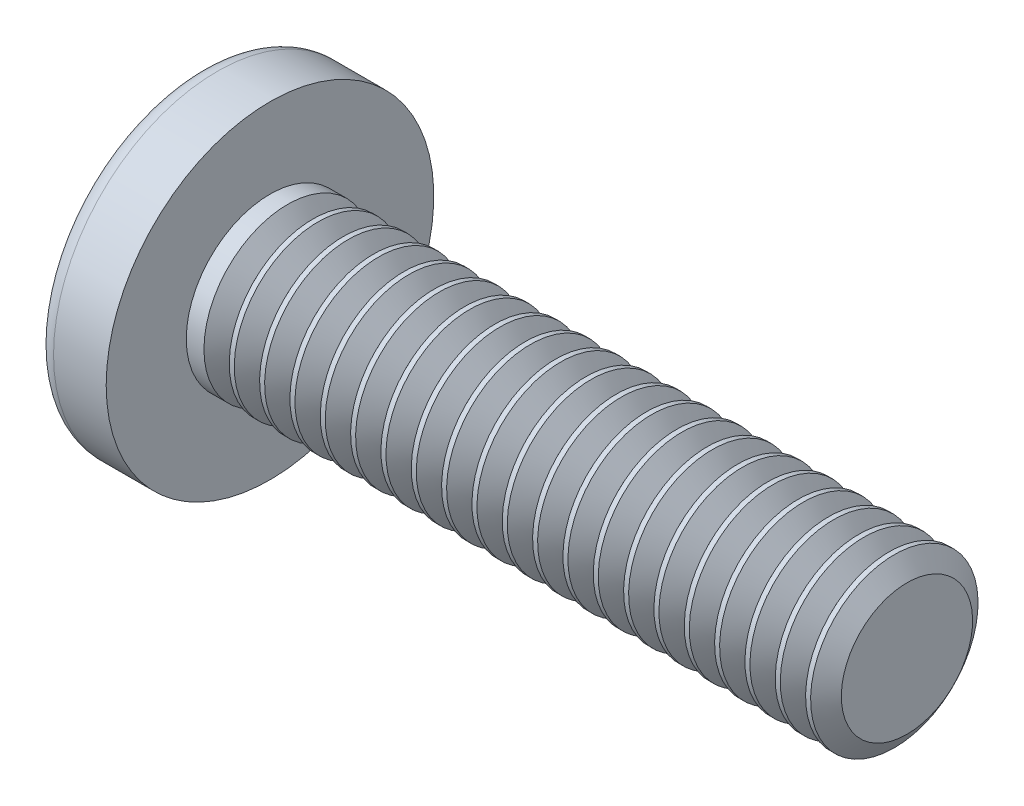
from build123d import *

# Parameters (mm, degrees)
CIRPATTERN1_COUNT = 2
CIRPATTERN1_ANGLE = 90
THDSCHPAT_COUNT   = 21
THDSCHPAT_PITCH   = 0.635


with BuildPart() as part:
    # BodySke → Base-Revolve (revolve)
    with BuildSketch(Plane.XY, mode=Mode.PRIVATE) as base_revolve_sk:
        with BuildLine():
            Line((2.4638, 1.7526), (2.4638, 3.429))
            Line((2.4638, 3.429), (1.361607109, 3.429))
            ThreePointArc((1.361607109, 3.429), (1.187654504, 3.386971225), (1.05207993, 3.270157434))
            ThreePointArc((1.05207993, 3.270157434), (0.269494964, 1.717614758), (0, 0))
            Line((0, 0), (15.7988, 0))
            Line((15.7988, 0), (15.7988, 1.7526))
            Line((15.7988, 1.7526), (2.4638, 1.7526))
        make_face()
    revolve(base_revolve_sk.sketch.rotate(Axis((-25.4, 0, 0), (1, 0, 0)), 90), axis=Axis((-25.4, 0, 0), (1, 0, 0)))

    # Sketch3 → Cut-Loft1 section 0
    with BuildSketch(Plane(origin=(0, 0, 0), x_dir=(0, 0, -1), z_dir=(1, 0, 0))):
        with BuildLine():
            Line((0.4699, -2.2352), (-0.4699, -2.2352))
            Line((-0.4699, -2.2352), (-0.4699, 2.2352))
            Line((-0.4699, 2.2352), (0.4699, 2.2352))
            Line((0.4699, 2.2352), (0.4699, -2.2352))
        make_face()
    # Sketch4 → Cut-Loft1 section 1
    with BuildSketch(Plane(origin=(2.4384, 0, 0), x_dir=(0, 0, -1), z_dir=(1, 0, 0))):
        with BuildLine():
            Line((0.23495, -0.23495), (-0.23495, -0.23495))
            Line((-0.23495, -0.23495), (-0.23495, 0.23495))
            Line((-0.23495, 0.23495), (0.23495, 0.23495))
            Line((0.23495, 0.23495), (0.23495, -0.23495))
        make_face()
    cut_loft1 = loft(mode=Mode.SUBTRACT)

    # CirPattern1: Cut-Loft1 ×2 about axis
    cirpattern1_axis = Axis((0, 0, 0), (1, 0, 0))
    for i in range(1, CIRPATTERN1_COUNT):
        add(cut_loft1.rotate(cirpattern1_axis, i * CIRPATTERN1_ANGLE / (CIRPATTERN1_COUNT - 1)), mode=Mode.SUBTRACT)

    # ThdSchSke → ThreadSchematic (revolve, cut)
    with BuildSketch(Plane.XY, mode=Mode.PRIVATE) as threadschematic_sk:
        Polygon((3.0988, -1.37414), (2.833799455, -1.7526), (2.833799455, -2.19075), (3.363800545, -2.19075), (3.363800545, -1.7526), align=None)
    threadschematic = revolve(threadschematic_sk.sketch.rotate(Axis((-3.175, 0, 0), (1, 0, 0)), 270), axis=Axis((-3.175, 0, 0), (1, 0, 0)), mode=Mode.SUBTRACT)

    # ThdSchPat: ThreadSchematic ×21
    with Locations(*[(i * THDSCHPAT_PITCH, 0, 0) for i in range(1, THDSCHPAT_COUNT)]):
        add(threadschematic, mode=Mode.SUBTRACT)


solid = part.part
